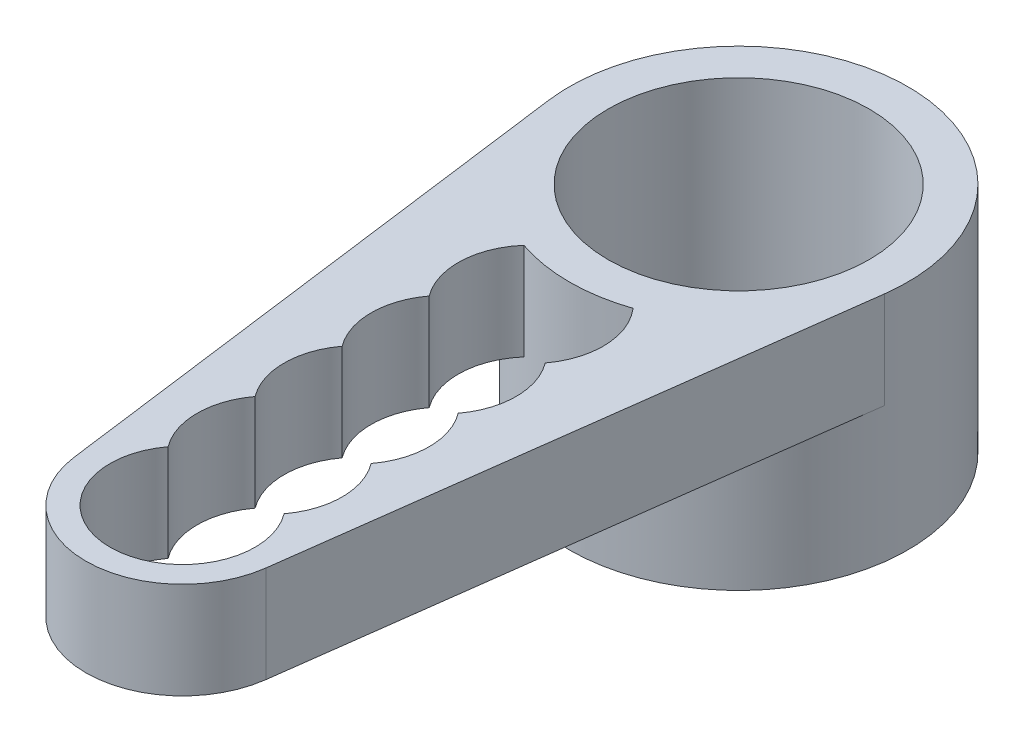
from build123d import *

# Parameters (mm, degrees)
SKETCH_1_R      = 3.5
SKETCH_1_R_2    = 2.7
EXTRUDE_1_DEPTH = 4.8
EXTRUDE_START   = -2
EXTRUDE_2_DEPTH = 2


with BuildPart() as part:
    # Эскиз1 → Бобышка-Вытянуть1 (new body)
    with BuildSketch(Plane(origin=(0, 0, 0), x_dir=(1, 0, 0), z_dir=(0, 1, 0))):
        Circle(SKETCH_1_R)
        Circle(SKETCH_1_R_2, mode=Mode.SUBTRACT)
    extrude(amount=EXTRUDE_1_DEPTH)

    # Эскиз2 → Бобышка-Вытянуть2 (add)
    with BuildSketch(Plane(origin=(0, 4.8, 0), x_dir=(1, 0, 0), z_dir=(0, 1, 0)).offset(EXTRUDE_START)):
        with BuildLine():
            ThreePointArc((-1.129343966, -3.312790698), (-2.707080949, -2.218493348), (-3.47009912, -0.456521739))
            Line((-3.47009912, -0.456521739), (-1.982913783, -11.760869565))
            ThreePointArc((-1.982913783, -11.760869565), (0, -13.5), (1.982913783, -11.760869565))
            Line((1.982913783, -11.760869565), (3.47009912, -0.456521739))
            ThreePointArc((3.47009912, -0.456521739), (2.707080949, -2.218493348), (1.129343966, -3.312790698))
            ThreePointArc((1.129343966, -3.312790698), (1.404282014, -3.772750509), (1.5, -4.3))
            ThreePointArc((1.5, -4.3), (1.423024947, -4.774341649), (1.2, -5.2))
            ThreePointArc((1.2, -5.2), (1.423024947, -5.625658351), (1.5, -6.1))
            ThreePointArc((1.5, -6.1), (1.423024947, -6.574341649), (1.2, -7))
            ThreePointArc((1.2, -7), (1.423024947, -7.425658351), (1.5, -7.9))
            ThreePointArc((1.5, -7.9), (1.423024947, -8.374341649), (1.2, -8.8))
            ThreePointArc((1.2, -8.8), (1.423024947, -9.225658351), (1.5, -9.7))
            ThreePointArc((1.5, -9.7), (1.423024947, -10.174341649), (1.2, -10.6))
            ThreePointArc((1.2, -10.6), (1.423024947, -11.025658351), (1.5, -11.5))
            ThreePointArc((1.5, -11.5), (-0.474341649, -12.923024947), (-1.2, -10.6))
            ThreePointArc((-1.2, -10.6), (-1.5, -9.7), (-1.2, -8.8))
            ThreePointArc((-1.2, -8.8), (-1.5, -7.9), (-1.2, -7))
            ThreePointArc((-1.2, -7), (-1.5, -6.1), (-1.2, -5.2))
            ThreePointArc((-1.2, -5.2), (-1.498949821, -4.243880178), (-1.129343966, -3.312790698))
        make_face()
    extrude(amount=EXTRUDE_2_DEPTH)


solid = part.part
